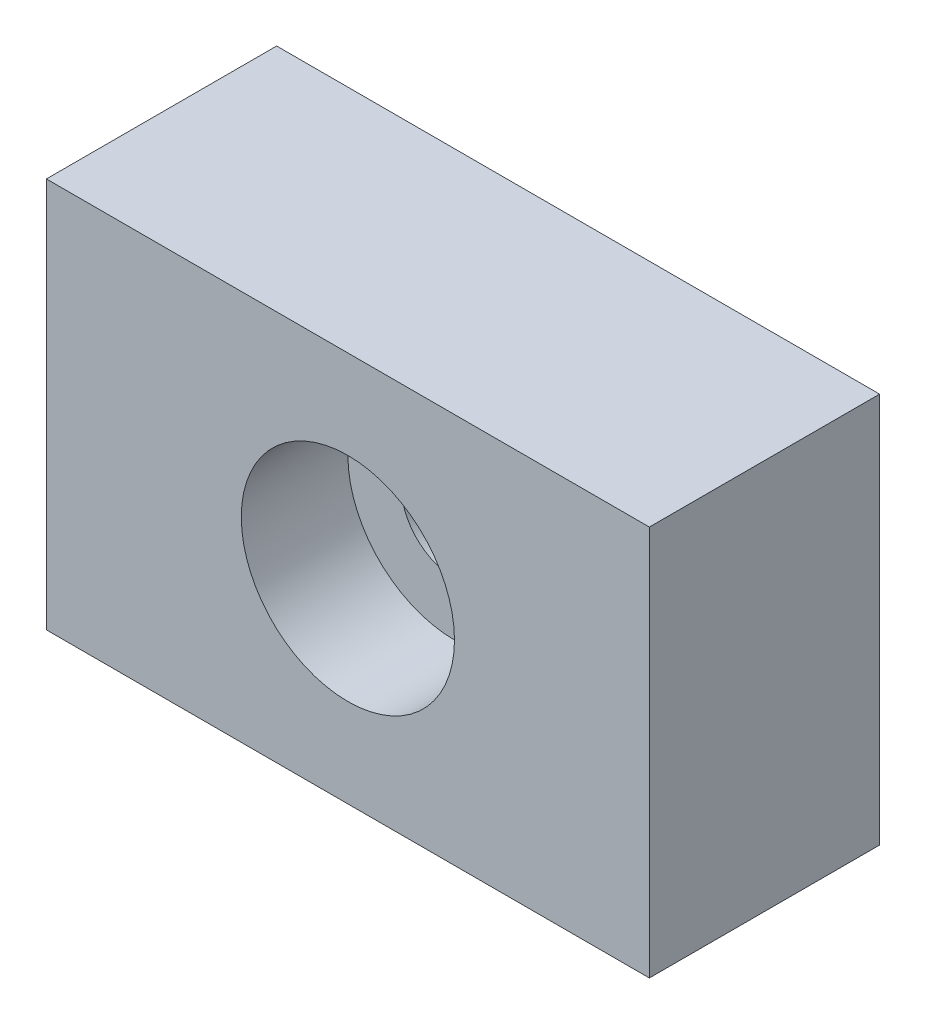
from build123d import *

# Parameters (mm, degrees)
SKETCH1_W           = 14.142143214
SKETCH1_H           = 9.160251854
SKETCH1_R           = 1.25
BOSS_EXTRUDE1_DEPTH = 5.4
SKETCH2_R           = 2.5
CUT_EXTRUDE1_DEPTH  = 2.5


with BuildPart() as part:
    # Sketch1 → Boss-Extrude1 (new body)
    with BuildSketch(Plane.XY):
        Rectangle(SKETCH1_W, SKETCH1_H)
        with Locations(Location((0, 0, 0), (0, 0, 180))):
            Circle(SKETCH1_R, mode=Mode.SUBTRACT)
    extrude(amount=BOSS_EXTRUDE1_DEPTH)

    # Sketch2 → Cut-Extrude1 (cut)
    with BuildSketch(Plane.XY.offset(5.4)):
        Circle(SKETCH2_R)
    extrude(amount=-CUT_EXTRUDE1_DEPTH, mode=Mode.SUBTRACT)


solid = part.part
